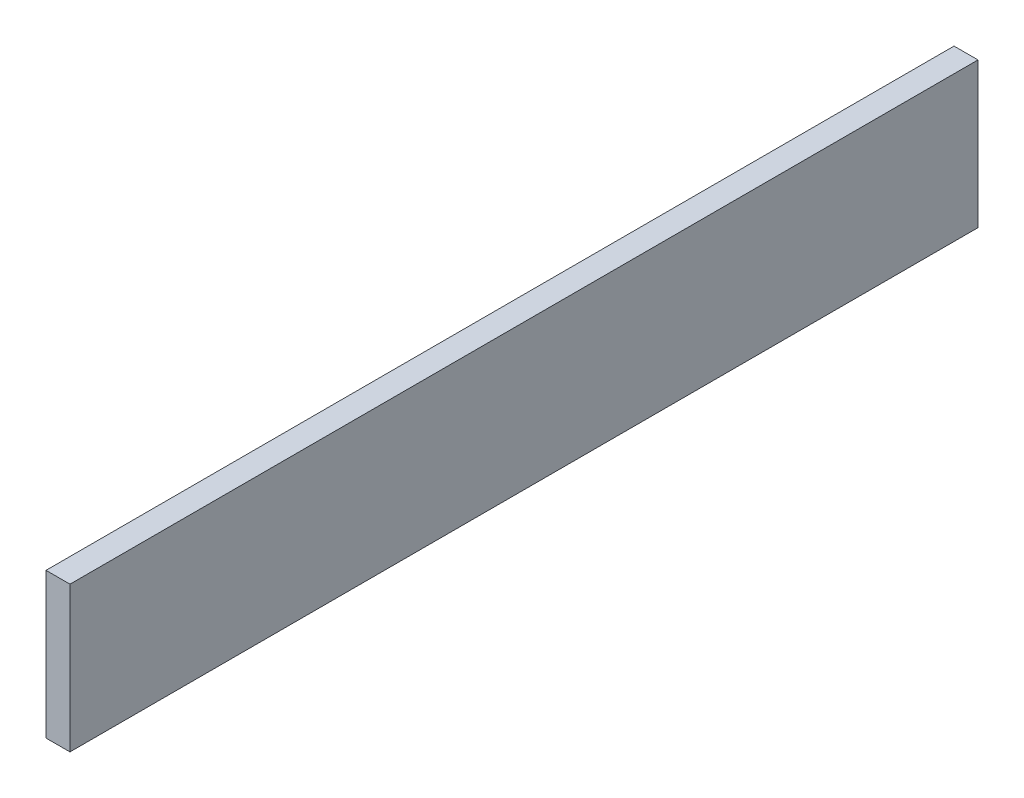
from build123d import *

# Parameters (mm, degrees)
ESBO_O1_W                = 19.8
ESBO_O1_H                = 120
RESSALTO_EXTRUS_O1_DEPTH = 750


with BuildPart() as part:
    # Esboço1 → Ressalto-extrusão1 (new body)
    with BuildSketch(Plane.XY):
        Rectangle(ESBO_O1_W, ESBO_O1_H)
    extrude(amount=-RESSALTO_EXTRUS_O1_DEPTH)


solid = part.part
